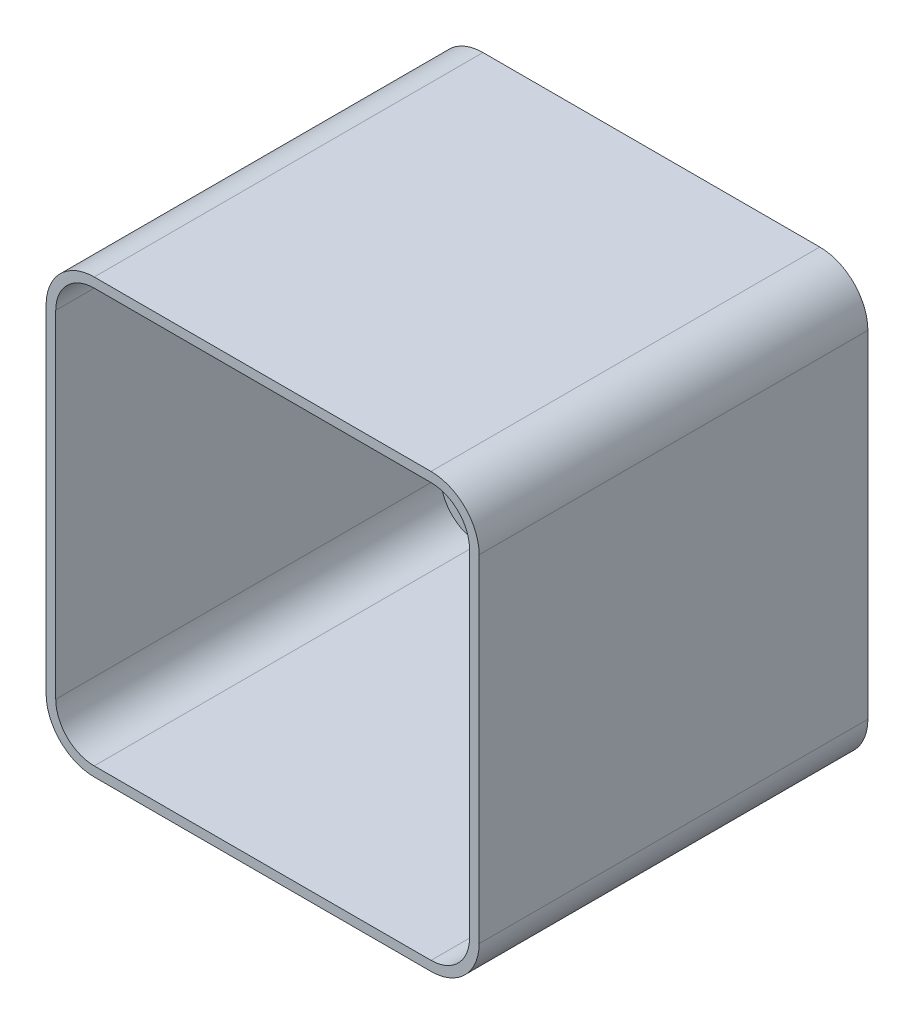
from build123d import *

# Parameters (mm, degrees)
BOSS_EXTRUDE1_DEPTH = 4
BOSS_EXTRUDE2_DEPTH = 400


with BuildPart() as part:
    # Sketch1 → Boss-Extrude1 (new body)
    with BuildSketch(Plane.XY):
        with BuildLine():
            Line((-175, 225), (175, 225))
            ThreePointArc((175, 225), (210.355339059, 210.355339059), (225, 175))
            Line((225, 175), (225, -175))
            ThreePointArc((225, -175), (210.355339059, -210.355339059), (175, -225))
            Line((175, -225), (-175, -225))
            ThreePointArc((-175, -225), (-210.355339059, -210.355339059), (-225, -175))
            Line((-225, -175), (-225, 175))
            ThreePointArc((-225, 175), (-210.355339059, 210.355339059), (-175, 225))
        make_face()
    extrude(amount=BOSS_EXTRUDE1_DEPTH)

    # Sketch2 → Boss-Extrude2 (add)
    with BuildSketch(Plane.XY.offset(4)):
        with BuildLine():
            Line((175, 225), (-175, 225))
            ThreePointArc((-175, 225), (-210.355339059, 210.355339059), (-225, 175))
            Line((-225, 175), (-225, -175))
            ThreePointArc((-225, -175), (-210.355339059, -210.355339059), (-175, -225))
            Line((-175, -225), (175, -225))
            ThreePointArc((175, -225), (210.355339059, -210.355339059), (225, -175))
            Line((225, -175), (225, 175))
            ThreePointArc((225, 175), (210.355339059, 210.355339059), (175, 225))
        make_face()
        with BuildLine():
            Line((-215, 175), (-215, -175))
            ThreePointArc((-215, -175), (-203.284271247, -203.284271247), (-175, -215))
            Line((-175, -215), (175, -215))
            ThreePointArc((175, -215), (203.284271247, -203.284271247), (215, -175))
            Line((215, -175), (215, 175))
            ThreePointArc((215, 175), (203.284271247, 203.284271247), (175, 215))
            Line((175, 215), (-175, 215))
            ThreePointArc((-175, 215), (-203.284271247, 203.284271247), (-215, 175))
        make_face(mode=Mode.SUBTRACT)
    extrude(amount=BOSS_EXTRUDE2_DEPTH)


solid = part.part
